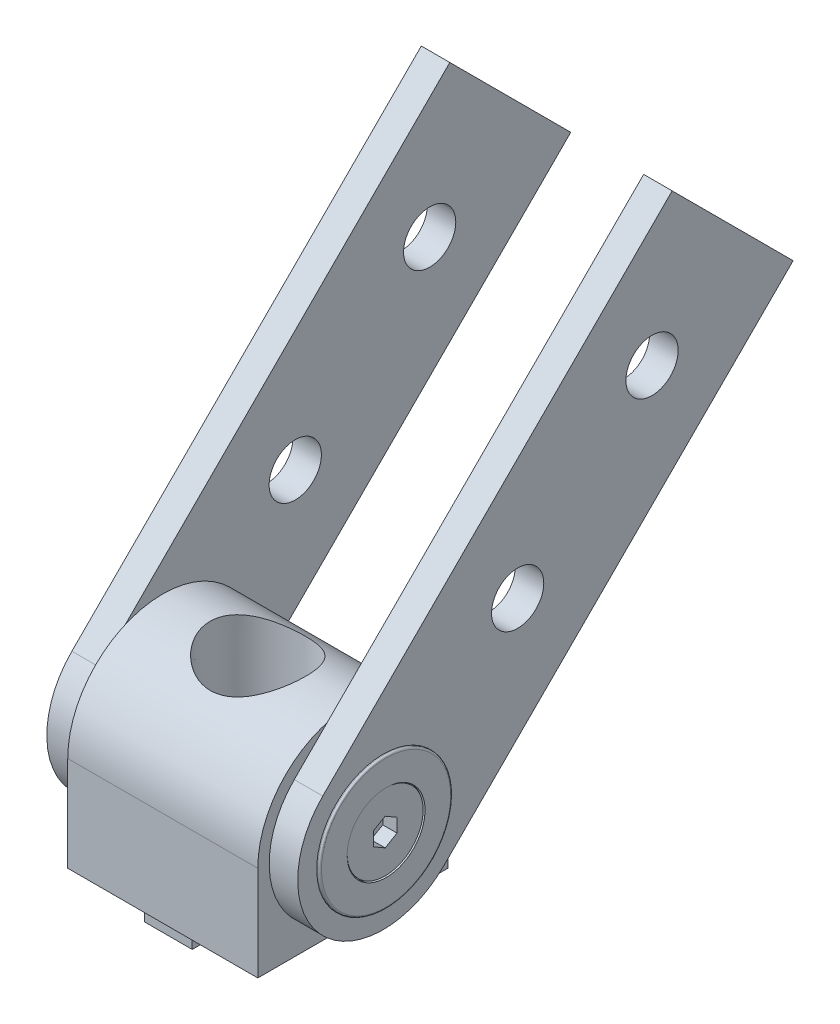
from build123d import *

# Parameters (mm, degrees)
SKETCH1_R                  = 1.65
BOSS_EXTRUDE1_DEPTH        = 10
SKETCH2_R                  = 4.5
CUT_EXTRUDE1_DEPTH         = 21.615528128
CUT_EXTRUDE1_DRAFT         = -2
SKETCH3_R                  = 2.65
CUT_EXTRUDE2_DEPTH         = 21.615528298
SKETCH4_W                  = 5
SKETCH4_H                  = 4.5
SKETCH4_W_2                = 4.5
SKETCH4_H_2                = 5
CUT_EXTRUDE3_DEPTH         = 4.1
BOSS_EXTRUDE2_DEPTH        = 1.45
BOSS_EXTRUDE2_DEPTH_BACK   = 4.1
SKETCH5_W                  = 5
SKETCH5_H                  = 4.5
BOSS_EXTRUDE2_2_DEPTH      = 1.45
BOSS_EXTRUDE2_2_DEPTH_BACK = 4.1
BOSS_EXTRUDE3_START        = -10.2
SKETCH6_R                  = 2.75
SKETCH6_R_2                = 7
BOSS_EXTRUDE3_DEPTH        = 3
CUT_EXTRUDE4_DEPTH         = 1.5


with BuildPart() as part:
    # Sketch1 → Boss-Extrude1 (new, symmetric)
    with BuildSketch(Plane(origin=(0, 0, 0), x_dir=(0, 0, -1), z_dir=(1, 0, 0))):
        with BuildLine():
            Line((-10, 10), (-10, 0))
            Line((-10, 0), (10, 0))
            Line((10, 0), (10, 10))
            ThreePointArc((10, 10), (0, 20), (-10, 10))
        make_face()
        with Locations((0, 10)):
            Circle(SKETCH1_R, mode=Mode.SUBTRACT)
    extrude(amount=BOSS_EXTRUDE1_DEPTH, both=True)


with BuildPart() as cut_extrude1_tool:
    # Sketch2 → Cut-Extrude1 (with draft: the straight prism first)
    with BuildSketch(Plane(origin=(0, 5, 0), x_dir=(-1, 0, 0), z_dir=(0, 1, 0))):
        Circle(SKETCH2_R)
    extrude(amount=CUT_EXTRUDE1_DEPTH)
    # Cut-Extrude1: the draft: its side faces are tilted about the plane it starts from
    cut_extrude1_sides = [cut_extrude1_tool.faces().sort_by_distance(p)[0] for p in [
        (4.5, 15.807764064, 0),
    ]]
    draft(cut_extrude1_sides, Plane(origin=(0, 5, 0), x_dir=(-1, 0, 0), z_dir=(0, 1, 0)), CUT_EXTRUDE1_DRAFT)


with BuildPart() as part_1:
    add(part.part)

    # Cut-Extrude1: cut by cut_extrude1_tool
    add(cut_extrude1_tool.part, mode=Mode.SUBTRACT)

    # Sketch3 → Cut-Extrude2 (cut, through all)
    with BuildSketch(Plane(origin=(0, 5, 0), x_dir=(1, 0, 0), z_dir=(0, 1, 0))):
        with Locations(Location((0, 0, 0), (0, 0, 270))):
            Circle(SKETCH3_R)
    extrude(amount=-CUT_EXTRUDE2_DEPTH, mode=Mode.SUBTRACT)

    # Sketch4 → Cut-Extrude3 (cut)
    with BuildSketch(Plane.XZ):
        with Locations((0, 7.15)):
            Rectangle(SKETCH4_W, SKETCH4_H)
        with Locations((0, -7.15)):
            Rectangle(SKETCH4_W, SKETCH4_H)
        with Locations((-7.15, 0)):
            Rectangle(SKETCH4_W_2, SKETCH4_H_2)
        with Locations((7.15, 0)):
            Rectangle(SKETCH4_W_2, SKETCH4_H_2)
    extrude(amount=-CUT_EXTRUDE3_DEPTH, mode=Mode.SUBTRACT)


with BuildPart() as body_2:
    # Sketch5 → Boss-Extrude2 (new, two sides: drawn at the far end of the back side and taken through both)
    with BuildSketch(Plane.XZ.offset(-BOSS_EXTRUDE2_DEPTH_BACK)):
        with Locations((0, 7.15)):
            Rectangle(SKETCH5_W, SKETCH5_H)
    extrude(amount=BOSS_EXTRUDE2_DEPTH + BOSS_EXTRUDE2_DEPTH_BACK)


with BuildPart() as body_3:
    # Sketch5 → Boss-Extrude2 2 (new, two sides: drawn at the far end of the back side and taken through both)
    with BuildSketch(Plane.XZ.offset(-BOSS_EXTRUDE2_2_DEPTH_BACK)):
        with Locations((0, -7.15)):
            Rectangle(SKETCH5_W, SKETCH5_H)
    extrude(amount=BOSS_EXTRUDE2_2_DEPTH + BOSS_EXTRUDE2_2_DEPTH_BACK)


with BuildPart() as body_4:
    # Sketch6 → Boss-Extrude3 (new body)
    with BuildSketch(Plane(origin=(0, 0, 0), x_dir=(0, 0, -1), z_dir=(1, 0, 0)).offset(BOSS_EXTRUDE3_START)):
        with BuildLine():
            Line((30.405591591, 53.133513652), (43.133513652, 40.405591591))
            Line((43.133513652, 40.405591591), (6.363961031, 3.636038969))
            ThreePointArc((6.363961031, 3.636038969), (-6.363961031, 3.636038969), (-6.363961031, 16.363961031))
            Line((-6.363961031, 16.363961031), (30.405591591, 53.133513652))
        make_face()
        with Locations((28.284271247, 38.284271247)):
            Circle(SKETCH6_R, mode=Mode.SUBTRACT)
        with Locations((14.142135624, 24.142135624)):
            Circle(SKETCH6_R, mode=Mode.SUBTRACT)
        with Locations((0, 10)):
            Circle(SKETCH6_R_2, mode=Mode.SUBTRACT)
    extrude(amount=-BOSS_EXTRUDE3_DEPTH)


with BuildPart() as body_5:
    # Sketch7 → Revolve1 (revolve)
    with BuildSketch(Plane.XY, mode=Mode.PRIVATE) as revolve1_sk:
        Polygon((-5.4, 10), (-5.4, 11.5), (-5.9, 12), (-11.1, 12), (-13.1, 14), (-13.4, 14), (-13.4, 10), align=None)
    revolve(revolve1_sk.sketch.rotate(Axis((-5.4, 10, 0), (1, 0, 0)), 90), axis=Axis((-5.4, 10, 0), (1, 0, 0)))

    # Sketch9 → Cut-Extrude4 (cut)
    with BuildSketch(Plane.ZY.offset(13.4)):
        Polygon((0, 11.443375673), (-1.25, 10.721687836), (-1.25, 9.278312164), (0, 8.556624327), (1.25, 9.278312164), (1.25, 10.721687836), align=None)
    extrude(amount=-CUT_EXTRUDE4_DEPTH, mode=Mode.SUBTRACT)


with BuildPart() as body_6:
    # Sketch8 → Revolve2 (revolve)
    with BuildSketch(Plane.XY):
        with BuildLine():
            Line((-13.3, 17), (-11.9, 17))
            ThreePointArc((-11.9, 17), (-11.758578644, 16.941421356), (-11.7, 16.8))
            Line((-11.7, 16.8), (-11.7, 13.1))
            Line((-11.7, 13.1), (-12.2, 13.1))
            Line((-12.2, 13.1), (-13.2, 14.1))
            Line((-13.2, 14.1), (-13.5, 14.1))
            Line((-13.5, 14.1), (-13.5, 16.8))
            ThreePointArc((-13.5, 16.8), (-13.441421356, 16.941421356), (-13.3, 17))
        make_face()
    revolve(axis=Axis((0, 10, 0), (-1, 0, 0)))


with BuildPart() as body_7:
    # Mirror1: mirrored copy
    add(body_4.part.mirror(Plane(origin=(0, 0, 0), x_dir=(0, 0, 1), z_dir=(1, 0, 0))))


with BuildPart() as body_8:
    # Mirror1 2: mirrored copy
    add(body_5.part.mirror(Plane(origin=(0, 0, 0), x_dir=(0, 0, 1), z_dir=(1, 0, 0))))


with BuildPart() as body_9:
    # Mirror1 3: mirrored copy
    add(body_6.part.mirror(Plane(origin=(0, 0, 0), x_dir=(0, 0, 1), z_dir=(1, 0, 0))))


solid = Compound([part_1.part, body_2.part, body_3.part, body_4.part, body_5.part, body_6.part, body_7.part, body_8.part, body_9.part])
